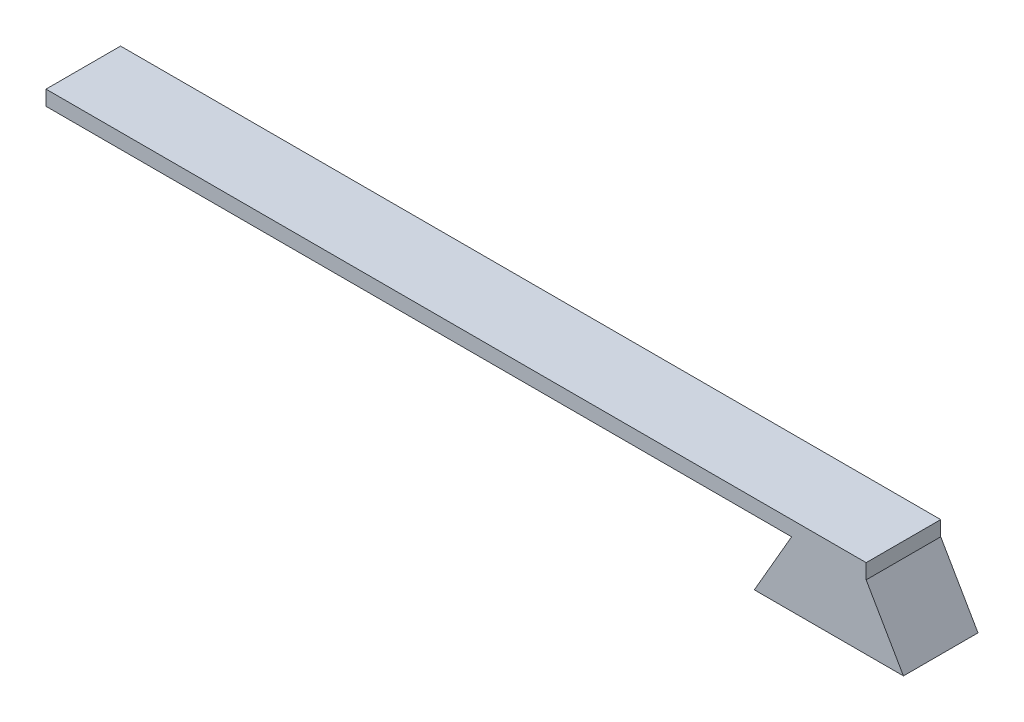
from build123d import *

# Parameters (mm, degrees)
SALIENTE_EXTRUIR1_DEPTH = 100
CROQUIS2_W              = 100
CROQUIS2_H              = 100
SALIENTE_EXTRUIR2_DEPTH = 20
CROQUIS3_W              = 100
CROQUIS3_H              = 20
SALIENTE_EXTRUIR3_DEPTH = 1000


with BuildPart() as part:
    # Croquis1 → Saliente-Extruir1 (new body)
    with BuildSketch(Plane.XY):
        Polygon((0, 0), (50, 86.602540378), (150, 86.602540378), (200, 0), align=None)
    extrude(amount=SALIENTE_EXTRUIR1_DEPTH)

    # Croquis2 → Saliente-Extruir2 (add)
    with BuildSketch(Plane(origin=(0, 86.602540378, 0), x_dir=(1, 0, 0), z_dir=(0, 1, 0))):
        with Locations((100, -50)):
            Rectangle(CROQUIS2_W, CROQUIS2_H)
    extrude(amount=SALIENTE_EXTRUIR2_DEPTH)

    # Croquis3 → Saliente-Extruir3 (add)
    with BuildSketch(Plane.ZY.offset(-50)):
        with Locations((50, 96.602540378)):
            Rectangle(CROQUIS3_W, CROQUIS3_H)
    extrude(amount=SALIENTE_EXTRUIR3_DEPTH)


solid = part.part
